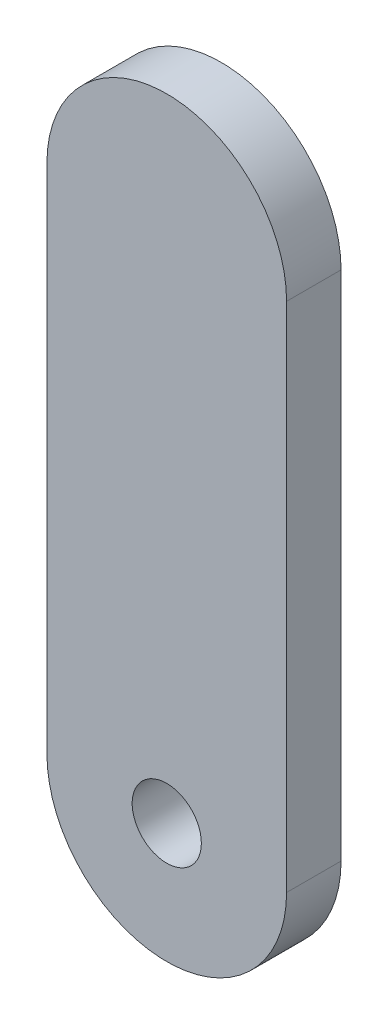
from build123d import *

# Parameters (mm, degrees)
SKETCH1_R           = 3.175
BOSS_EXTRUDE1_DEPTH = 5


with BuildPart() as part:
    # Sketch1 → Boss-Extrude1 (new body)
    with BuildSketch(Plane.XY):
        with BuildLine():
            Line((11, 0), (11, 47))
            ThreePointArc((11, 47), (0, 58), (-11, 47))
            Line((-11, 47), (-11, 0))
            ThreePointArc((-11, 0), (0, -11), (11, 0))
        make_face()
        Circle(SKETCH1_R, mode=Mode.SUBTRACT)
    extrude(amount=BOSS_EXTRUDE1_DEPTH)


solid = part.part
